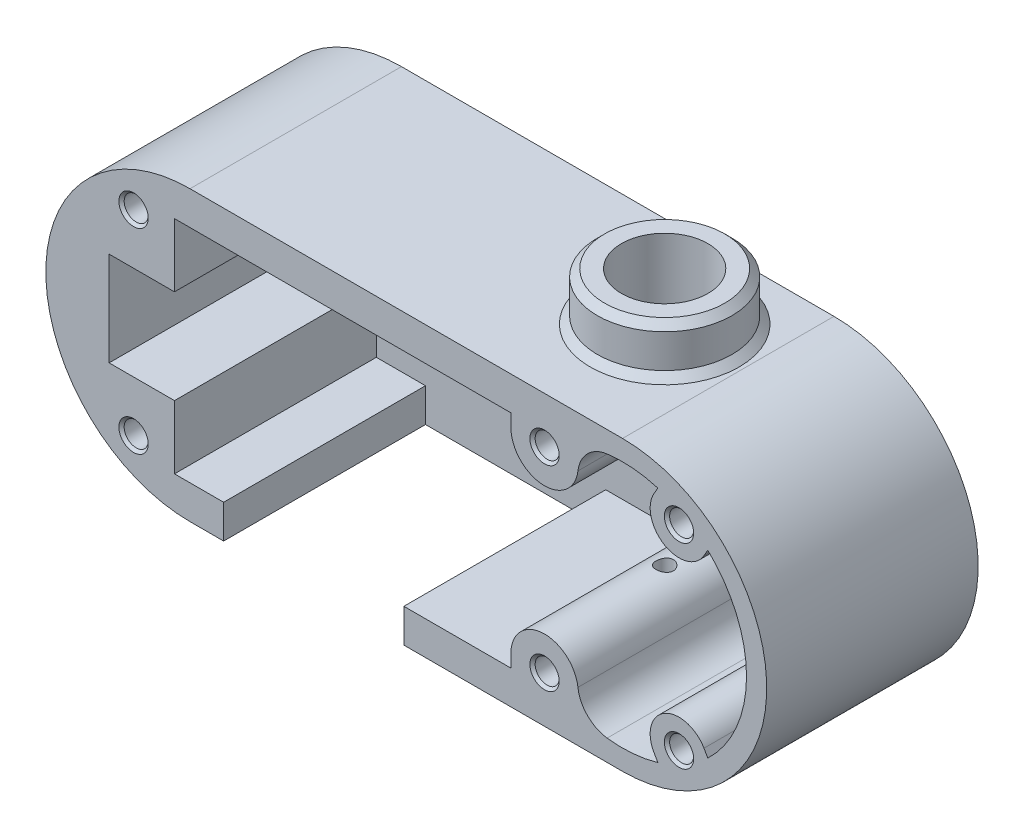
from build123d import *

# Parameters (mm, degrees)
BOSS_EXTRUDE1_DEPTH         = 25
CUT_EXTRUDE1_DEPTH          = 21
CUT_EXTRUDE2_DEPTH          = 16.25
M3_TAPPED_HOLE1_D           = 2.5
M3_TAPPED_HOLE1_DEPTH       = 8.5
M3_TAPPED_HOLE1_CSINK_D     = 3.05
M3_TAPPED_HOLE1_CSINK_ANGLE = 90
M3_TAPPED_HOLE1_TIP         = 0.751075774
SKETCH5_R                   = 7
BOSS_EXTRUDE2_DEPTH         = 5
SKETCH6_R                   = 4.5
CUT_EXTRUDE3_DEPTH          = 7
SKETCH7_R                   = 2.15
CUT_EXTRUDE4_DEPTH          = 4.5
CHAMFER2_SIZE               = 1.5
CHAMFER2_SIZE2              = 3
CUT_EXTRUDE5_REACH          = 64.204
CUT_EXTRUDE5_END_RADIUS     = 3.5
SKETCH8_R                   = 0.9
CHAMFER2_OF_MIRROR1_SIZE2   = 1.5
CHAMFER2_OF_MIRROR1_SIZE    = 3
CHAMFER3_SIZE               = 4.5
CHAMFER3_SIZE2              = 3
CHAMFER4_SIZE               = 0.75


with BuildPart() as part:
    # Sketch1 → Boss-Extrude1 (new body)
    with BuildSketch(Plane.XY):
        with BuildLine():
            Line((-36.885, 15), (8.115, 15))
            ThreePointArc((8.115, 15), (23.115, 0), (8.115, -15))
            Line((8.115, -15), (-36.885, -15))
            ThreePointArc((-36.885, -15), (-51.885, 0), (-36.885, 15))
        make_face()
    extrude(amount=BOSS_EXTRUDE1_DEPTH)

    # Sketch2 → Cut-Extrude1 (cut)
    with BuildSketch(Plane.XY.offset(25)):
        with BuildLine():
            Line((-3.5, 11.5), (-38.5, 11.5))
            Line((-38.5, 11.5), (-38.5, 4.9))
            Line((-38.5, 4.9), (-45.3, 4.9))
            Line((-45.3, 4.9), (-45.3, -4.9))
            Line((-45.3, -4.9), (-38.5, -4.9))
            Line((-38.5, -4.9), (-38.5, -11.5))
            Line((-38.5, -11.5), (-33.385, -11.5))
            Line((-33.385, -11.5), (-33.385, -16.5))
            Line((-33.385, -16.5), (-14.635, -16.5))
            Line((-14.635, -16.5), (-14.635, -11.5))
            Line((-14.635, -11.5), (-3.5, -11.5))
            Line((-3.5, -11.5), (-3.5, -10.175))
            ThreePointArc((-3.5, -10.175), (-3.031207817, -8.425205963), (-1.750411903, -7.144148936))
            ThreePointArc((-1.750411903, -7.144148936), (2.373617184, 0), (-1.750411903, 7.144148936))
            ThreePointArc((-1.750411903, 7.144148936), (-3.031207817, 8.425205963), (-3.5, 10.175))
            Line((-3.5, 10.175), (-3.5, 11.5))
        make_face()
    extrude(amount=-CUT_EXTRUDE1_DEPTH, mode=Mode.SUBTRACT)

    # Sketch2<3> → Cut-Extrude2 (cut)
    with BuildSketch(Plane.XY.offset(25)):
        with BuildLine():
            ThreePointArc((3.474243454, 9.75116935), (1.562702039, 7.043233352), (-1.750411903, 7.144148936))
            ThreePointArc((-1.750411903, 7.144148936), (2.373617184, 0), (-1.750411903, -7.144148936))
            ThreePointArc((-1.750411903, -7.144148936), (1.562702039, -7.043233352), (3.474243454, -9.75116935))
            ThreePointArc((3.474243454, -9.75116935), (4.469872156, -11.798465751), (6.514146928, -12.800283959))
            ThreePointArc((6.514146928, -12.800283959), (9.174878964, -12.856385829), (11.79050107, -12.365301933))
            Line((11.79050107, -12.365301933), (11.391974761, -11.675088283))
            ThreePointArc((11.391974761, -11.675088283), (12.489911717, -7.576974761), (16.588025239, -8.674911717))
            Line((16.588025239, -8.674911717), (16.986551548, -9.365125367))
            ThreePointArc((16.986551548, -9.365125367), (21.015, 0), (16.986551548, 9.365125367))
            Line((16.986551548, 9.365125367), (16.588025239, 8.674911717))
            ThreePointArc((16.588025239, 8.674911717), (12.489911717, 7.576974761), (11.391974761, 11.675088283))
            Line((11.391974761, 11.675088283), (11.79050107, 12.365301933))
            ThreePointArc((11.79050107, 12.365301933), (9.174878964, 12.856385829), (6.514146928, 12.800283959))
            ThreePointArc((6.514146928, 12.800283959), (4.469872156, 11.798465751), (3.474243454, 9.75116935))
        make_face()
    extrude(amount=-CUT_EXTRUDE2_DEPTH, mode=Mode.SUBTRACT)

    # M3 Tapped Hole1
    with Locations(Plane.XY.offset(25)):
        with Locations((-42.76, 10.175), (-42.76, -10.175), (0, -10.175), (0, 10.175), (13.99, 10.175), (13.99, -10.175)):
            CounterSinkHole(M3_TAPPED_HOLE1_D / 2, M3_TAPPED_HOLE1_CSINK_D / 2, depth=M3_TAPPED_HOLE1_DEPTH, counter_sink_angle=M3_TAPPED_HOLE1_CSINK_ANGLE)
            with Locations((0, 0, -(M3_TAPPED_HOLE1_DEPTH + M3_TAPPED_HOLE1_TIP / 2))):  # 118° drill point
                Cone(0, M3_TAPPED_HOLE1_D / 2, M3_TAPPED_HOLE1_TIP, mode=Mode.SUBTRACT)

    # Sketch5 → Boss-Extrude2 (add)
    with BuildSketch(Plane(origin=(0, 15, 0), x_dir=(1, 0, 0), z_dir=(0, 1, 0))):
        with Locations((0, -12.5)):
            Circle(SKETCH5_R)
    boss_extrude2 = extrude(amount=BOSS_EXTRUDE2_DEPTH)

    # Sketch6 → Cut-Extrude3 (cut)
    with BuildSketch(Plane(origin=(0, 20, 0), x_dir=(1, 0, 0), z_dir=(0, 1, 0))):
        with Locations(Location((0, -12.5, 0), (0, 0, 180))):
            Circle(SKETCH6_R)
    cut_extrude3 = extrude(amount=-CUT_EXTRUDE3_DEPTH, mode=Mode.SUBTRACT)

    # Sketch7 → Cut-Extrude4 (cut)
    with BuildSketch(Plane(origin=(0, 13, 0), x_dir=(1, 0, 0), z_dir=(0, 1, 0))):
        with Locations(Location((0, -12.5, 0), (0, 0, 180))):
            Circle(SKETCH7_R)
    cut_extrude4 = extrude(amount=-CUT_EXTRUDE4_DEPTH, mode=Mode.SUBTRACT)

    # Chamfer2
    chamfer2_edges = [part.edges().sort_by_distance(p)[0] for p in [
        (2.15, 13, 12.5),
    ]]
    chamfer2_side = [part.faces().sort_by_distance(p)[0] for p in [
        (4.372720779, 13, 12.5),
    ]]
    chamfer(chamfer2_edges, length=CHAMFER2_SIZE, length2=CHAMFER2_SIZE2, reference=chamfer2_side[0])

    # Cut-Extrude5: up to this cylinder (the profile starts inside it)
    cut_extrude5_end = Plane(origin=(0, 10.175, 12.5), z_dir=(0, 0, 1)) * Cylinder(CUT_EXTRUDE5_END_RADIUS, 136.408, mode=Mode.PRIVATE)
    # Sketch8 → Cut-Extrude5 (cut, up to the surface)
    with BuildSketch(Plane(origin=(0, 8.5, 0), x_dir=(1, 0, 0), z_dir=(0, 1, 0)), mode=Mode.PRIVATE) as cut_extrude5_sk1:
        with Locations(Location((0, -12.5, 0), (0, 0, 180))):
            Circle(SKETCH8_R)
    cut_extrude5_tool1 = extrude(cut_extrude5_sk1.sketch, amount=-CUT_EXTRUDE5_REACH, mode=Mode.PRIVATE) & cut_extrude5_end
    cut_extrude5 = cut_extrude5_tool1.solids().sort_by_distance((0, 8.5, 12.5))[0]
    add(cut_extrude5, mode=Mode.SUBTRACT)

    # Mirror1: Boss-Extrude2, Cut-Extrude3, Cut-Extrude4, Cut-Extrude5 across plane
    add(boss_extrude2.mirror(Plane.ZX))
    add(cut_extrude3.mirror(Plane.ZX), mode=Mode.SUBTRACT)
    add(cut_extrude4.mirror(Plane.ZX), mode=Mode.SUBTRACT)
    add(cut_extrude5.mirror(Plane.ZX), mode=Mode.SUBTRACT)

    # Chamfer2 of Mirror1
    chamfer2_of_mirror1_edges = [part.edges().sort_by_distance(p)[0] for p in [
        (2.15, -13, 12.5),
    ]]
    chamfer(chamfer2_of_mirror1_edges, length=CHAMFER2_OF_MIRROR1_SIZE, length2=CHAMFER2_OF_MIRROR1_SIZE2)

    # Chamfer3
    chamfer3_edges = [part.edges().sort_by_distance(p)[0] for p in [
        (-14.385, 15, 0),
        (23.115, 0, 0),
        (-14.385, -15, 0),
        (-51.885, 0, 0),
    ]]
    chamfer3_side = [part.faces().sort_by_distance(p)[0] for p in [
        (-14.385, 0, 0),
    ]]
    chamfer(chamfer3_edges, length=CHAMFER3_SIZE, length2=CHAMFER3_SIZE2, reference=chamfer3_side[0])

    # Chamfer4
    chamfer4_edges = [part.edges().sort_by_distance(p)[0] for p in [
        (-7, 15, 12.5),
        (-7, 20, 12.5),
        (-7, -20, 12.5),
        (-7, -15, 12.5),
    ]]
    chamfer(chamfer4_edges, length=CHAMFER4_SIZE)


solid = part.part
